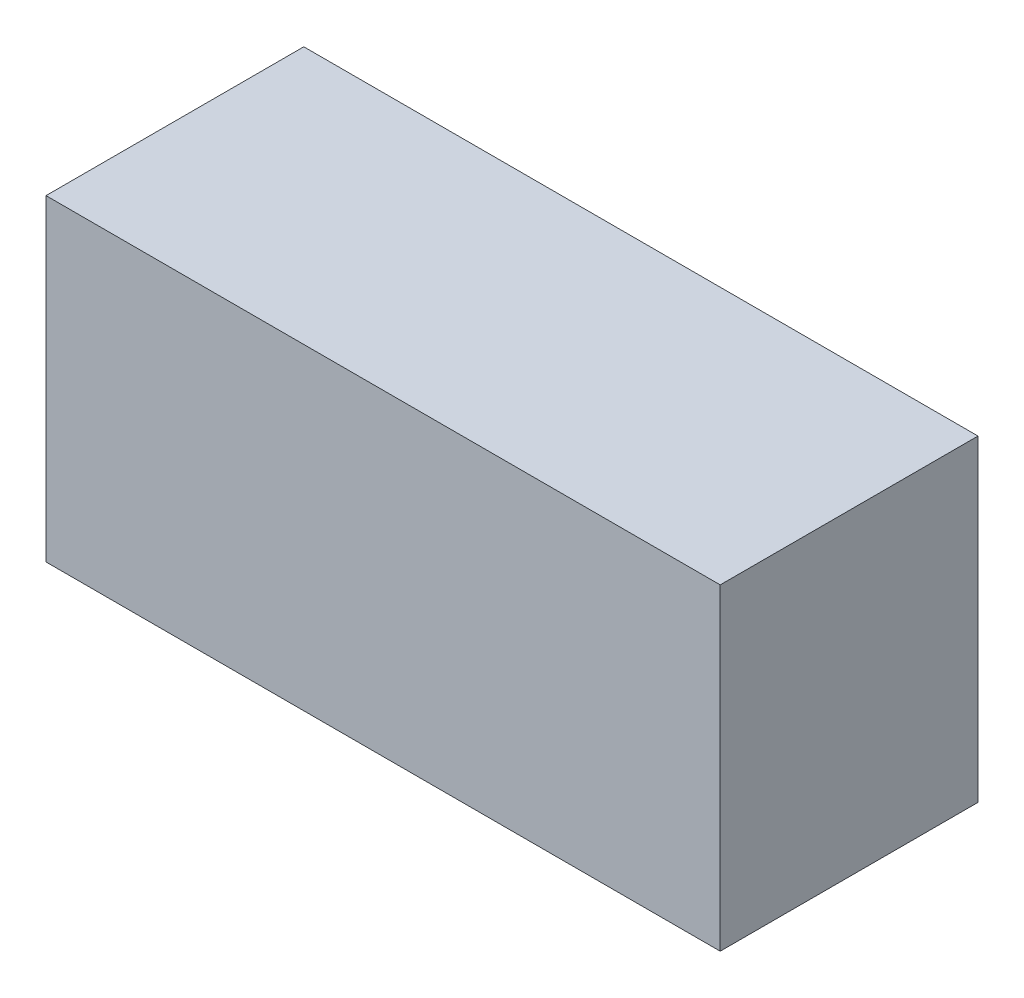
from build123d import *

# Parameters (mm, degrees)
SKETCH1_W               = 1.6999966
SKETCH1_H               = 0.7999984
COMPONENT_OUTLINE_DEPTH = 0.6500114


with BuildPart() as part:
    # Sketch1 → Component_Outline (new body)
    with BuildSketch(Plane.XY):
        with Locations((1.0249789, 0)):
            Rectangle(SKETCH1_W, SKETCH1_H)
    extrude(amount=COMPONENT_OUTLINE_DEPTH)


solid = part.part
